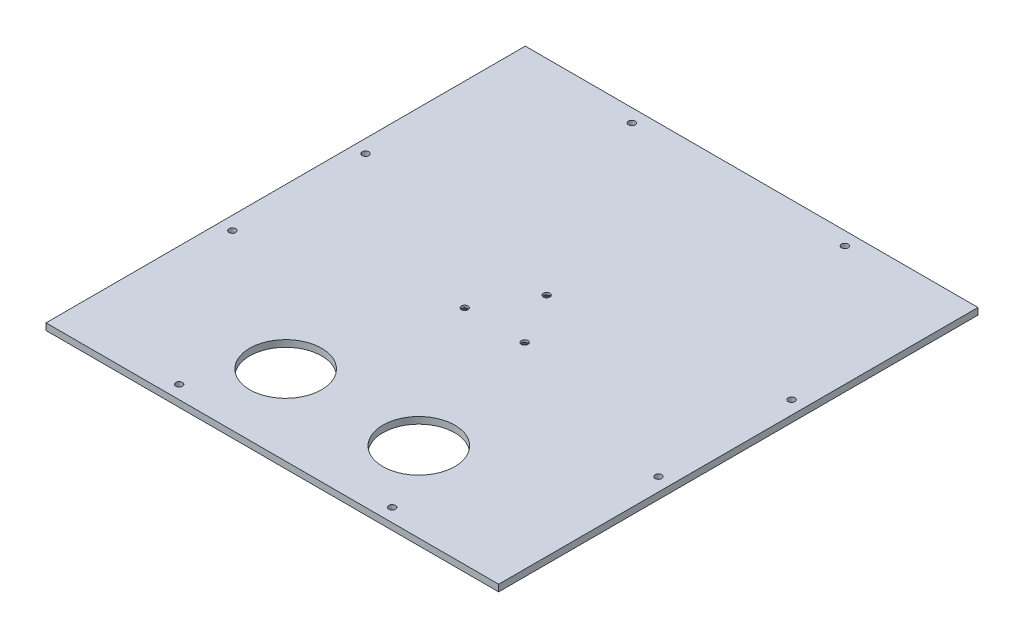
from build123d import *
from OCP.BRepFilletAPI import BRepFilletAPI_MakeChamfer

# Parameters (mm, degrees)
SKETCH1_W           = 215.9
SKETCH1_H           = 228.6
BOSS_EXTRUDE1_DEPTH = 3.175
SKETCH2_R           = 17.145
CUT_EXTRUDE1_DEPTH  = 315.453256661
SKETCH3_R           = 1.5875
CUT_EXTRUDE2_DEPTH  = 315.453256661
SKETCH4_R           = 1.5875
CUT_EXTRUDE3_DEPTH  = 315.453256661
CHAMFER1_SIZE       = 2.1082
CHAMFER1_SIZE2      = 1.832630301
SKETCH5_W           = 25.4
SKETCH5_H           = 50.8
SKETCH5_H_2         = 25.4
SKETCH5_W_2         = 50.8
SKETCH5_W_3         = 76.2
SKETCH5_H_3         = 88.9
CUT_EXTRUDE4_DEPTH  = 1.5875
FILLET1_R           = 3.175
FILLET2_R           = 25.4


with BuildPart() as part:
    # Sketch1 → Boss-Extrude1 (new body)
    with BuildSketch(Plane(origin=(0, 0, 0), x_dir=(1, 0, 0), z_dir=(0, 1, 0))):
        with Locations((107.95, 114.3)):
            Rectangle(SKETCH1_W, SKETCH1_H)
    extrude(amount=BOSS_EXTRUDE1_DEPTH)

    # Sketch2 → Cut-Extrude1 (cut, through all)
    with BuildSketch(Plane(origin=(0, 3.175, 0), x_dir=(1, 0, 0), z_dir=(0, 1, 0))):
        with Locations(Location((139.7, 38.1, 0), (0, 0, 270))):
            Circle(SKETCH2_R)
        with Locations(Location((76.2, 38.1, 0), (0, 0, 270))):
            Circle(SKETCH2_R)
    extrude(amount=-CUT_EXTRUDE1_DEPTH, mode=Mode.SUBTRACT)

    # Sketch3 → Cut-Extrude2 (cut, through all)
    with BuildSketch(Plane(origin=(0, 3.175, 0), x_dir=(1, 0, 0), z_dir=(0, 1, 0))):
        with Locations(Location((107.95, 130.81, 0), (0, 0, 270))):
            Circle(SKETCH3_R)
        with Locations(Location((122.248079416, 106.045, 0), (0, 0, 270))):
            Circle(SKETCH3_R)
        with Locations(Location((93.651920584, 106.045, 0), (0, 0, 270))):
            Circle(SKETCH3_R)
    extrude(amount=-CUT_EXTRUDE2_DEPTH, mode=Mode.SUBTRACT)

    # Sketch4 → Cut-Extrude3 (cut, through all)
    with BuildSketch(Plane(origin=(0, 3.175, 0), x_dir=(1, 0, 0), z_dir=(0, 1, 0))):
        with Locations(Location((6.35, 146.05, 0), (0, 0, 270))):
            Circle(SKETCH4_R)
        with Locations(Location((6.35, 82.55, 0), (0, 0, 270))):
            Circle(SKETCH4_R)
        with Locations(Location((57.15, 6.35, 0), (0, 0, 270))):
            Circle(SKETCH4_R)
        with Locations(Location((57.15, 222.25, 0), (0, 0, 270))):
            Circle(SKETCH4_R)
        with Locations(Location((158.75, 6.35, 0), (0, 0, 90))):
            Circle(SKETCH4_R)
        with Locations(Location((209.55, 82.55, 0), (0, 0, 90))):
            Circle(SKETCH4_R)
        with Locations(Location((209.55, 146.05, 0), (0, 0, 90))):
            Circle(SKETCH4_R)
        with Locations(Location((158.75, 222.25, 0), (0, 0, 90))):
            Circle(SKETCH4_R)
    extrude(amount=-CUT_EXTRUDE3_DEPTH, mode=Mode.SUBTRACT)

    # Chamfer1: one chamfer whose edges measure the first distance from different faces: ONE call of the kernel's chamfer builder (chamfer() names one face for all edges)
    chamfer1_edges_1 = [part.edges().sort_by_distance(p)[0] for p in [
        (107.95, 0, -132.3975),
    ]]
    chamfer1_side_1 = [part.faces().sort_by_distance(p)[0] for p in [
        (107.95, 1.5875, -132.3975),
    ]]
    chamfer1_edges_2 = [part.edges().sort_by_distance(p)[0] for p in [
        (122.248079416, 0, -107.6325),
    ]]
    chamfer1_side_2 = [part.faces().sort_by_distance(p)[0] for p in [
        (122.248079416, 1.5875, -107.6325),
    ]]
    chamfer1_edges_3 = [part.edges().sort_by_distance(p)[0] for p in [
        (93.651920584, 0, -107.6325),
    ]]
    chamfer1_side_3 = [part.faces().sort_by_distance(p)[0] for p in [
        (93.651920584, 1.5875, -107.6325),
    ]]
    chamfer1 = BRepFilletAPI_MakeChamfer(part.part.solid().wrapped)
    for e in chamfer1_edges_1:
        chamfer1.Add(CHAMFER1_SIZE, CHAMFER1_SIZE2, e.wrapped, chamfer1_side_1[0].wrapped)  # the first distance lies on this face
    for e in chamfer1_edges_2:
        chamfer1.Add(CHAMFER1_SIZE, CHAMFER1_SIZE2, e.wrapped, chamfer1_side_2[0].wrapped)  # the first distance lies on this face
    for e in chamfer1_edges_3:
        chamfer1.Add(CHAMFER1_SIZE, CHAMFER1_SIZE2, e.wrapped, chamfer1_side_3[0].wrapped)  # the first distance lies on this face
    add(Compound.cast(chamfer1.Shape()), mode=Mode.REPLACE)

    # Sketch5 → Cut-Extrude4 (cut)
    with BuildSketch(Plane.XZ):
        with Locations((31.75, -44.45)):
            Rectangle(SKETCH5_W, SKETCH5_H)
        with Locations((31.75, -82.55)):
            Rectangle(SKETCH5_W, SKETCH5_H_2)
        with Locations((69.85, -82.55)):
            Rectangle(SKETCH5_W_2, SKETCH5_H_2)
        with Locations((57.15, -165.1)):
            Rectangle(SKETCH5_W_3, SKETCH5_H_3)
        with Locations((158.75, -165.1)):
            Rectangle(SKETCH5_W_3, SKETCH5_H_3)
        with Locations((146.05, -82.55)):
            Rectangle(SKETCH5_W_2, SKETCH5_H_2)
        with Locations((184.15, -82.55)):
            Rectangle(SKETCH5_W, SKETCH5_H_2)
        with Locations((184.15, -44.45)):
            Rectangle(SKETCH5_W, SKETCH5_H)
    extrude(amount=-CUT_EXTRUDE4_DEPTH, mode=Mode.SUBTRACT)

    # Fillet1
    fillet1_edges = [part.edges().sort_by_distance(p)[0] for p in [
        (120.65, 0.79375, -120.65),
        (196.85, 0.79375, -120.65),
        (196.85, 0.79375, -209.55),
        (120.65, 0.79375, -209.55),
        (19.05, 0.79375, -120.65),
        (95.25, 0.79375, -120.65),
        (95.25, 0.79375, -209.55),
        (19.05, 0.79375, -209.55),
        (19.05, 0.79375, -95.25),
        (19.05, 0.79375, -19.05),
        (44.45, 0.79375, -19.05),
        (95.25, 0.79375, -69.85),
        (95.25, 0.79375, -95.25),
        (196.85, 0.79375, -95.25),
        (120.65, 0.79375, -95.25),
        (120.65, 0.79375, -69.85),
        (171.45, 0.79375, -19.05),
        (196.85, 0.79375, -19.05),
    ]]
    fillet(fillet1_edges, radius=FILLET1_R)

    # Fillet2
    fillet2_edges = [part.edges().sort_by_distance(p)[0] for p in [
        (44.45, 0.79375, -69.85),
        (171.45, 0.79375, -69.85),
    ]]
    fillet(fillet2_edges, radius=FILLET2_R)


solid = part.part
